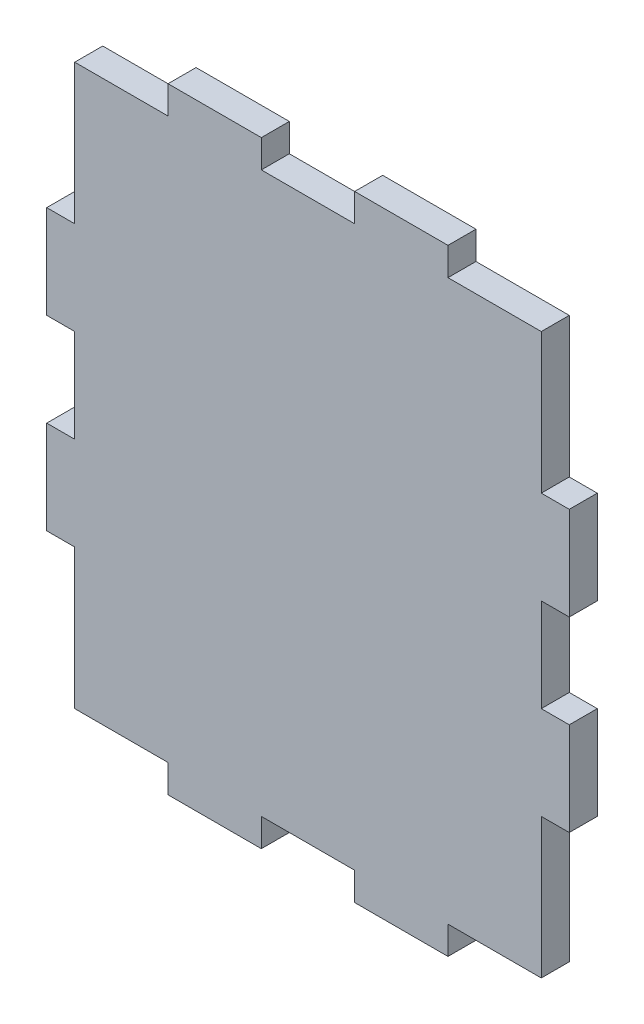
from build123d import *

# Parameters (mm, degrees)
RESSALTO_EXTRUS_O1_DEPTH = 6


with BuildPart() as part:
    # Esboço1 → Ressalto-extrusão1 (new body)
    with BuildSketch(Plane.XY):
        Polygon((-40, 0), (-20, 0), (-20, 6), (0, 6), (0, 0), (20, 0), (20, 6), (40, 6), (40, 0), (60, 0), (60, -30), (66, -30), (66, -50), (60, -50), (60, -70), (66, -70), (66, -90), (60, -90), (60, -120), (40, -120), (40, -126), (20, -126), (20, -120), (0, -120), (0, -126), (-20, -126), (-20, -120), (-40, -120), (-40, -90), (-46, -90), (-46, -70), (-40, -70), (-40, -50), (-46, -50), (-46, -30), (-40, -30), align=None)
    extrude(amount=RESSALTO_EXTRUS_O1_DEPTH)


solid = part.part
